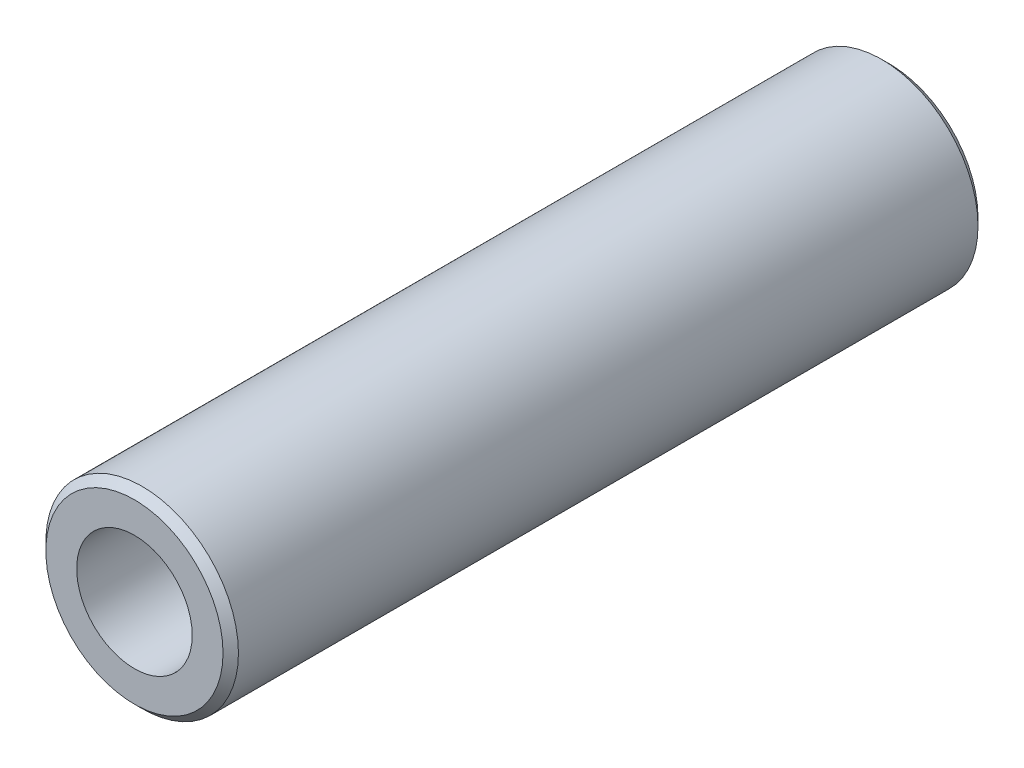
from build123d import *

# Parameters (mm, degrees)
SKETCH1_R           = 6.25
SKETCH1_R_2         = 3.75
EXTRUDE_THIN1_DEPTH = 24.5
CHAMFER1_SIZE       = 0.5


with BuildPart() as part:
    # Sketch1 → Extrude-Thin1 (new, symmetric)
    with BuildSketch(Plane.XY):
        Circle(SKETCH1_R)
        Circle(SKETCH1_R_2, mode=Mode.SUBTRACT)
    extrude(amount=EXTRUDE_THIN1_DEPTH, both=True)

    # Chamfer1
    chamfer1_edges = [part.edges().sort_by_distance(p)[0] for p in [
        (-6.25, 0, -24.5),
        (-6.25, 0, 24.5),
    ]]
    chamfer(chamfer1_edges, length=CHAMFER1_SIZE)


solid = part.part
